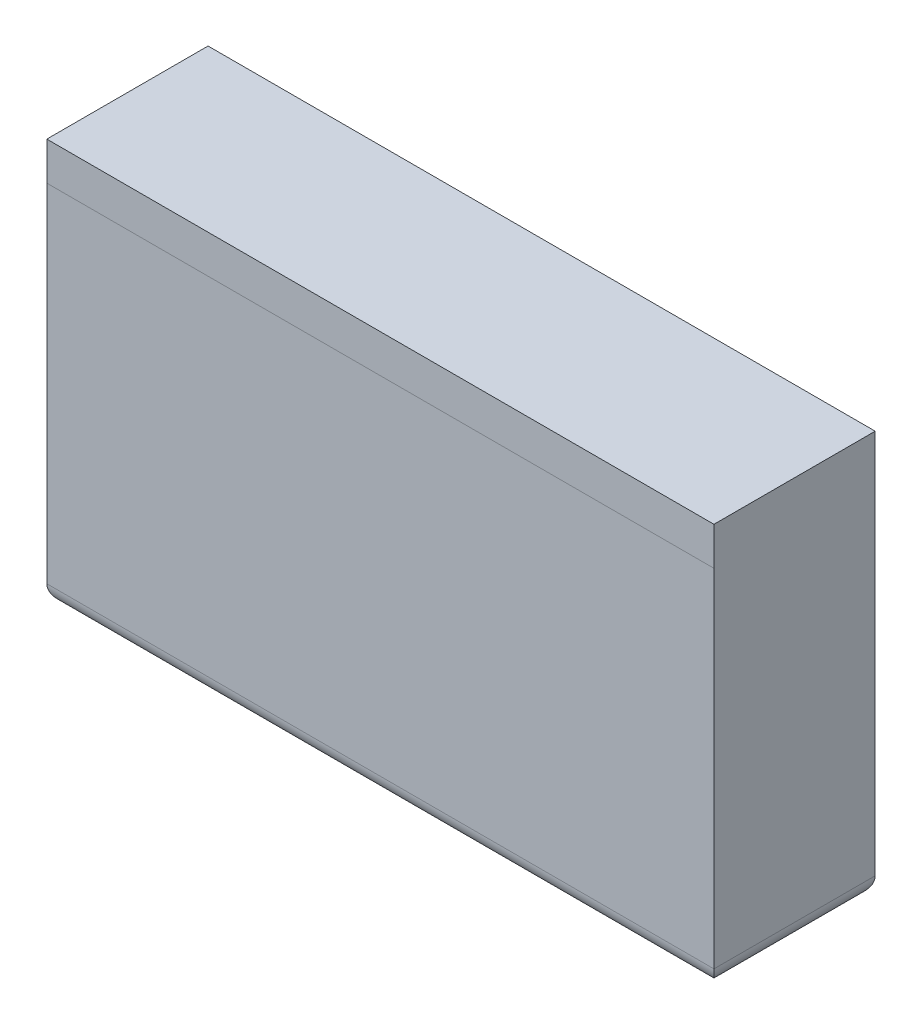
from build123d import *

# Parameters (mm, degrees)
SKETCH1_W           = 175
SKETCH1_H           = 42.3
BOSS_EXTRUDE1_DEPTH = 4
SKETCH1_3_W         = 175
SKETCH1_3_H         = 42.3
SKETCH1_3_W_2       = 167
SKETCH1_3_H_2       = 34.3
BOSS_EXTRUDE2_DEPTH = 96
SKETCH1_4_R         = 5
BOSS_EXTRUDE3_DEPTH = 10
FILLET1_R           = 5
SKETCH3_W           = 78.73
SKETCH3_H           = 11.03
CUT_EXTRUDE1_DEPTH  = 4
SKETCH4_W           = 174.998654926
SKETCH4_H           = 42.297309852
BOSS_EXTRUDE4_DEPTH = 10


with BuildPart() as part:
    # Sketch1 → Boss-Extrude1 (new body)
    with BuildSketch(Plane(origin=(0, 0, 0), x_dir=(1, 0, 0), z_dir=(0, 1, 0))):
        with Locations((35.322931561, 0)):
            Rectangle(SKETCH1_W, SKETCH1_H)
    extrude(amount=BOSS_EXTRUDE1_DEPTH)

    # Sketch1<3> → Boss-Extrude2 (add)
    with BuildSketch(Plane(origin=(0, 0, 0), x_dir=(1, 0, 0), z_dir=(0, 1, 0))):
        with Locations((35.322931561, 0)):
            Rectangle(SKETCH1_3_W, SKETCH1_3_H)
        with Locations((35.322931561, 0)):
            Rectangle(SKETCH1_3_W_2, SKETCH1_3_H_2, mode=Mode.SUBTRACT)
    extrude(amount=BOSS_EXTRUDE2_DEPTH)

    # Sketch1<4> → Boss-Extrude3 (add)
    with BuildSketch(Plane(origin=(0, 0, 0), x_dir=(1, 0, 0), z_dir=(0, 1, 0))):
        with Locations((-32.177068439, 0)):
            Circle(SKETCH1_4_R)
        with Locations((102.822931561, 0)):
            Circle(SKETCH1_4_R)
    extrude(amount=-BOSS_EXTRUDE3_DEPTH)

    # Fillet1
    fillet1_edges = [part.edges().sort_by_distance(p)[0] for p in [
        (35.322931561, 0, 21.15),
        (-52.177068439, 0, 0),
        (35.322931561, 0, -21.15),
        (122.822931561, 0, 0),
    ]]
    fillet(fillet1_edges, radius=FILLET1_R)

    # Sketch3 → Cut-Extrude1 (cut)
    with BuildSketch(Plane(origin=(0, 0, -21.15), x_dir=(-1, 0, 0), z_dir=(0, 0, -1))):
        with Locations((-35.322931561, 10.515)):
            Rectangle(SKETCH3_W, SKETCH3_H)
    extrude(amount=-CUT_EXTRUDE1_DEPTH, mode=Mode.SUBTRACT)

    # Sketch4 → Boss-Extrude4 (add)
    with BuildSketch(Plane(origin=(0, 96, 0), x_dir=(1, 0, 0), z_dir=(0, 1, 0))):
        with Locations((35.323604098, 0)):
            Rectangle(SKETCH4_W, SKETCH4_H)
    extrude(amount=BOSS_EXTRUDE4_DEPTH)


solid = part.part
